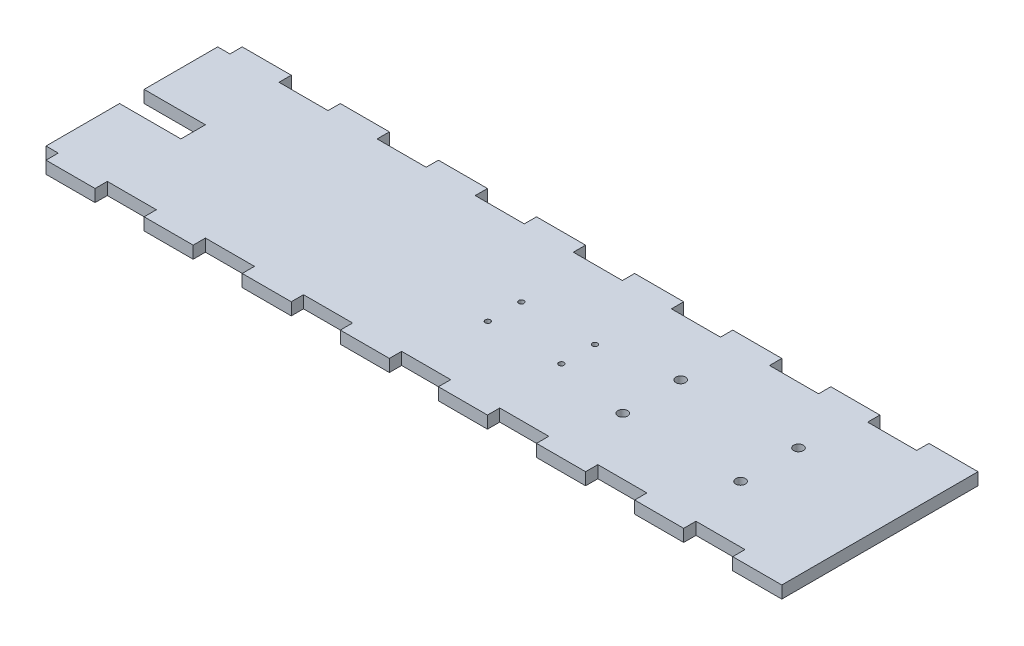
from build123d import *

# Parameters (mm, degrees)
BOSS_EXTRUDE1_DEPTH = 3.175
SKETCH2_W           = 12.7
SKETCH2_H           = 6.35
CUT_EXTRUDE1_DEPTH  = 198.182581951
SKETCH3_W           = 19.05
SKETCH3_H           = 3.175
BOSS_EXTRUDE2_DEPTH = 6.35
SKETCH5_R           = 1.25
SKETCH5_R_2         = 0.6731
CUT_EXTRUDE3_DEPTH  = 198.182581951
SKETCH6_W           = 3.175
SKETCH6_H           = 44.45
CUT_EXTRUDE4_DEPTH  = 198.182581951


with BuildPart() as part:
    # Sketch1 → Boss-Extrude1 (new body)
    with BuildSketch(Plane(origin=(0, 0, 0), x_dir=(1, 0, 0), z_dir=(0, 1, 0))):
        Polygon((12.7, 0), (0, 0), (0, -50.8), (12.7, -50.8), (12.7, -47.625), (25.4, -47.625), (25.4, -50.8), (38.1, -50.8), (38.1, -47.625), (50.8, -47.625), (50.8, -50.8), (63.5, -50.8), (63.5, -47.625), (76.2, -47.625), (76.2, -50.8), (88.9, -50.8), (88.9, -47.625), (101.6, -47.625), (101.6, -50.8), (114.3, -50.8), (114.3, -47.625), (127, -47.625), (127, -50.8), (139.7, -50.8), (139.7, -47.625), (152.4, -47.625), (152.4, -50.8), (165.1, -50.8), (165.1, -47.625), (177.8, -47.625), (177.8, -50.8), (190.5, -50.8), (190.5, 0), (177.8, 0), (177.8, -3.175), (165.1, -3.175), (165.1, 0), (152.4, 0), (152.4, -3.175), (139.7, -3.175), (139.7, 0), (127, 0), (127, -3.175), (114.3, -3.175), (114.3, 0), (101.6, 0), (101.6, -3.175), (88.9, -3.175), (88.9, 0), (76.2, 0), (76.2, -3.175), (63.5, -3.175), (63.5, 0), (50.8, 0), (50.8, -3.175), (38.1, -3.175), (38.1, 0), (25.4, 0), (25.4, -3.175), (12.7, -3.175), align=None)
    extrude(amount=BOSS_EXTRUDE1_DEPTH)

    # Sketch2 → Cut-Extrude1 (cut, through all)
    with BuildSketch(Plane(origin=(0, 3.175, 0), x_dir=(1, 0, 0), z_dir=(0, 1, 0))):
        with Locations((6.35, -25.4)):
            Rectangle(SKETCH2_W, SKETCH2_H)
    extrude(amount=-CUT_EXTRUDE1_DEPTH, mode=Mode.SUBTRACT)

    # Sketch3 → Boss-Extrude2 (add)
    with BuildSketch(Plane.ZY):
        with Locations((12.7, 1.5875)):
            Rectangle(SKETCH3_W, SKETCH3_H)
        with Locations((38.1, 1.5875)):
            Rectangle(SKETCH3_W, SKETCH3_H)
    extrude(amount=BOSS_EXTRUDE2_DEPTH)

    # Sketch5 → Cut-Extrude3 (cut, through all)
    with BuildSketch(Plane(origin=(0, 3.175, 0), x_dir=(1, 0, 0), z_dir=(0, 1, 0))):
        with Locations(Location((131.425, -17.9, 0), (0, 0, 270))):
            Circle(SKETCH5_R)
        with Locations(Location((131.425, -32.9, 0), (0, 0, 270))):
            Circle(SKETCH5_R)
        with Locations(Location((112.375, -21.0566, 0), (0, 0, 270))):
            Circle(SKETCH5_R_2)
        with Locations(Location((112.375, -29.7434, 0), (0, 0, 270))):
            Circle(SKETCH5_R_2)
        with Locations(Location((93.325, -29.7434, 0), (0, 0, 270))):
            Circle(SKETCH5_R_2)
        with Locations(Location((93.325, -21.0566, 0), (0, 0, 270))):
            Circle(SKETCH5_R_2)
        with Locations(Location((161.925, -32.9, 0), (0, 0, 270))):
            Circle(SKETCH5_R)
        with Locations(Location((161.925, -17.9, 0), (0, 0, 270))):
            Circle(SKETCH5_R)
    extrude(amount=-CUT_EXTRUDE3_DEPTH, mode=Mode.SUBTRACT)

    # Sketch6 → Cut-Extrude4 (cut, through all)
    with BuildSketch(Plane(origin=(0, 3.175, 0), x_dir=(1, 0, 0), z_dir=(0, 1, 0))):
        with Locations((-4.7625, -25.4)):
            Rectangle(SKETCH6_W, SKETCH6_H)
    extrude(amount=-CUT_EXTRUDE4_DEPTH, mode=Mode.SUBTRACT)


solid = part.part
